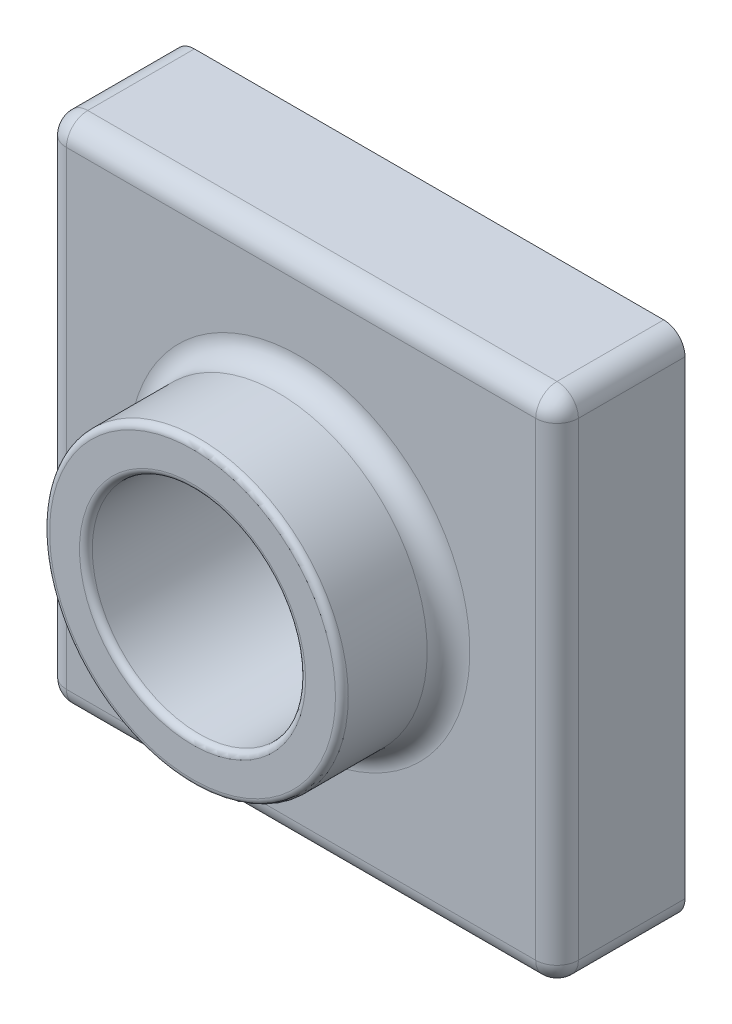
from build123d import *

# Parameters (mm, degrees)
SKETCH1_W           = 120
SKETCH1_H           = 120
BOSS_EXTRUDE1_DEPTH = 30
SKETCH3_R           = 35
BOSS_EXTRUDE4_DEPTH = 25
SKETCH7_R           = 25
CUT_EXTRUDE1_DEPTH  = 179.395627749
FILLET1_R           = 5
FILLET2_R           = 1.5
SHELL1_T            = -2


with BuildPart() as part:
    # Sketch1 → Boss-Extrude1 (new body)
    with BuildSketch(Plane.XY):
        with Locations((60, 60)):
            Rectangle(SKETCH1_W, SKETCH1_H)
    extrude(amount=BOSS_EXTRUDE1_DEPTH)

    # Sketch3 → Boss-Extrude4 (add)
    with BuildSketch(Plane.XY.offset(30)):
        with Locations((59.564639484, 60)):
            Circle(SKETCH3_R)
    extrude(amount=BOSS_EXTRUDE4_DEPTH)

    # Sketch7 → Cut-Extrude1 (cut, through all)
    with BuildSketch(Plane(origin=(0, 0, 0), x_dir=(-1, 0, 0), z_dir=(0, 0, -1))):
        with Locations((-59.564639484, 60)):
            Circle(SKETCH7_R)
    extrude(amount=-CUT_EXTRUDE1_DEPTH, mode=Mode.SUBTRACT)

    # Fillet1
    fillet1_edges = [part.edges().sort_by_distance(p)[0] for p in [
        (120, 60, 30),
        (24.564639484, 60, 30),
        (60, 120, 30),
        (0, 60, 30),
        (0, 120, 15),
        (120, 120, 15),
        (120, 0, 15),
        (0, 0, 15),
        (60, 0, 30),
    ]]
    fillet(fillet1_edges, radius=FILLET1_R)

    # Fillet2
    fillet2_edges = [part.edges().sort_by_distance(p)[0] for p in [
        (24.564639484, 60, 55),
        (84.564639484, 60, 55),
    ]]
    fillet(fillet2_edges, radius=FILLET2_R)

    # Shell1
    shell1_openings = [part.faces().sort_by_distance(p)[0] for p in [
        (60, 1.697056275, 0),
    ]]
    offset(amount=SHELL1_T, openings=shell1_openings, kind=Kind.INTERSECTION)


solid = part.part
